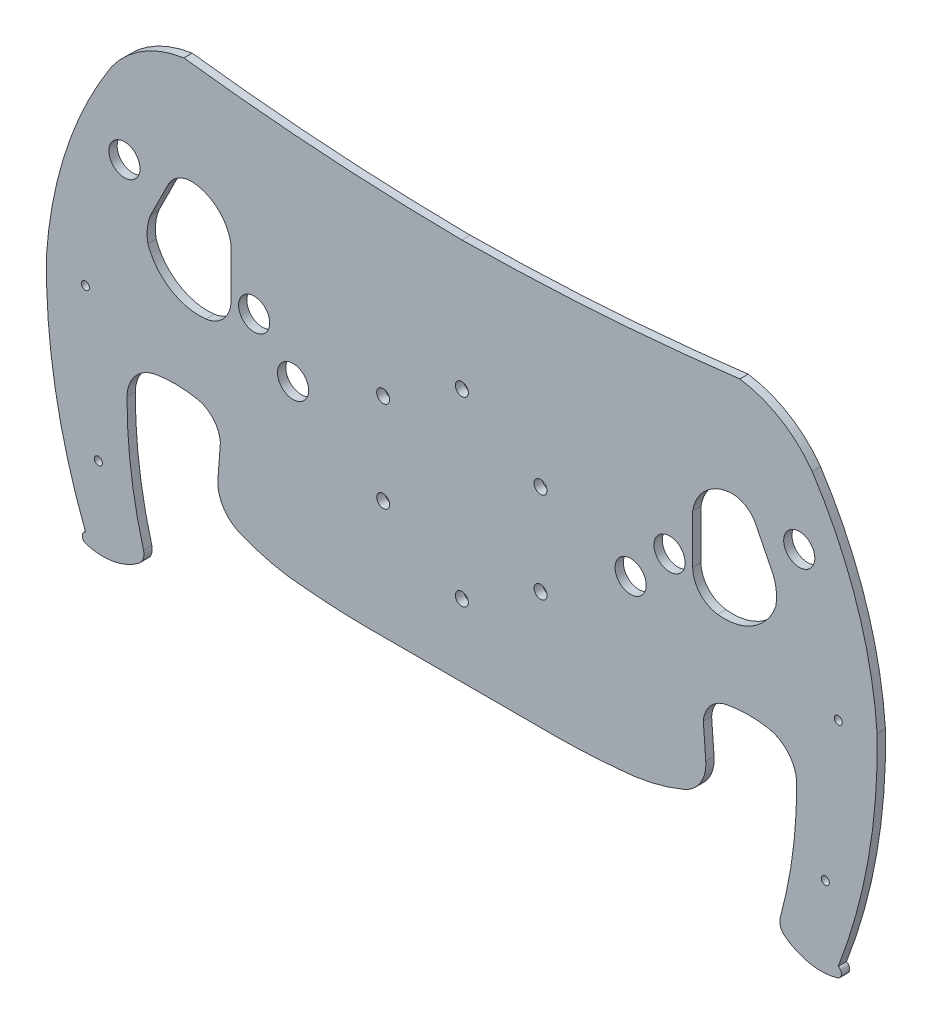
from build123d import *

# Parameters (mm, degrees)
SKETCH2_R           = 1.55
SKETCH2_R_2         = 6
SKETCH2_R_3         = 2.5
BOSS_EXTRUDE1_DEPTH = 3.2


with BuildPart() as part:
    # Sketch2 → Boss-Extrude1 (new body)
    with BuildSketch(Plane.XY):
        with BuildLine():
            Line((-37.606688888, -62.799107474), (37.606688888, -62.799107474))
            ThreePointArc((37.606688888, -62.799107474), (48.801571995, -62.445486831), (59.972328875, -61.630228563))
            ThreePointArc((59.972328875, -61.630228563), (73.015089975, -59.821162533), (85.558909279, -55.816298707))
            ThreePointArc((85.558909279, -55.816298707), (91.976349194, -50.332295109), (93.972328875, -42.130228563))
            Line((93.972328875, -42.130228563), (93.027953895, -29.351478281))
            ThreePointArc((93.027953895, -29.351478281), (95.742249073, -22.868177437), (101.827930469, -19.351777277))
            ThreePointArc((101.827930469, -19.351777277), (109.903770401, -18.491114916), (118, -19.132205072))
            ThreePointArc((118, -19.132205072), (125.861366739, -23.634125523), (129, -32.132205072))
            ThreePointArc((129, -32.132205072), (127.471762842, -56.297585918), (122.65808311, -80.027938374))
            ThreePointArc((122.65808311, -80.027938374), (122.741653332, -82.9548656), (124.449843954, -85.333094304))
            ThreePointArc((124.449843954, -85.333094304), (134.106812923, -89.628818458), (144.665008336, -89.144251365))
            ThreePointArc((144.665008336, -89.144251365), (146.218821849, -87.253980838), (145, -85.132205072))
            ThreePointArc((145, -85.132205072), (156.646327108, -43.296671083), (159.999998592, 0))
            ThreePointArc((159.999998592, 0), (152.263680347, 39.087893918), (134.999998592, 75))
            ThreePointArc((134.999998592, 75), (122.785714167, 86.318698338), (107.103701402, 91.920140268))
            ThreePointArc((107.103701402, 91.920140268), (53.654087158, 86.806881933), (0, 84.746395368))
            ThreePointArc((0, 84.746395368), (-53.654087158, 86.806881933), (-107.103701402, 91.920140268))
            ThreePointArc((-107.103701402, 91.920140268), (-122.785714167, 86.318698338), (-134.999998592, 75))
            ThreePointArc((-134.999998592, 75), (-152.263680347, 39.087893918), (-159.999998592, 0))
            ThreePointArc((-159.999998592, 0), (-156.646327108, -43.296671083), (-145, -85.132205072))
            ThreePointArc((-145, -85.132205072), (-146.218821849, -87.253980838), (-144.665008336, -89.144251365))
            ThreePointArc((-144.665008336, -89.144251365), (-134.106812923, -89.628818458), (-124.449843954, -85.333094304))
            ThreePointArc((-124.449843954, -85.333094304), (-122.741653332, -82.9548656), (-122.65808311, -80.027938374))
            ThreePointArc((-122.65808311, -80.027938374), (-127.471762842, -56.297585918), (-129, -32.132205072))
            ThreePointArc((-129, -32.132205072), (-125.861366739, -23.634125523), (-118, -19.132205072))
            ThreePointArc((-118, -19.132205072), (-109.903770401, -18.491114916), (-101.827930469, -19.351777277))
            ThreePointArc((-101.827930469, -19.351777277), (-95.742249073, -22.868177437), (-93.027953895, -29.351478281))
            Line((-93.027953895, -29.351478281), (-93.972328875, -42.130228563))
            ThreePointArc((-93.972328875, -42.130228563), (-91.976349194, -50.332295109), (-85.558909279, -55.816298707))
            ThreePointArc((-85.558909279, -55.816298707), (-73.015089975, -59.821162533), (-59.972328875, -61.630228563))
            ThreePointArc((-59.972328875, -61.630228563), (-48.801571995, -62.445486831), (-37.606688888, -62.799107474))
        make_face()
        with Locations((145.027741118, -2.999996549)):
            Circle(SKETCH2_R, mode=Mode.SUBTRACT)
        with Locations((80.027671125, 20)):
            Circle(SKETCH2_R_2, mode=Mode.SUBTRACT)
        with Locations((140.027625835, -59.000005176)):
            Circle(SKETCH2_R, mode=Mode.SUBTRACT)
        with Locations((129.987526969, 46.510623474)):
            Circle(SKETCH2_R_2, mode=Mode.SUBTRACT)
        with Locations((65.027671125, 5)):
            Circle(SKETCH2_R_2, mode=Mode.SUBTRACT)
        with Locations((0, 35)):
            Circle(SKETCH2_R_3, mode=Mode.SUBTRACT)
        with Locations((30.310889132, 17.5)):
            Circle(SKETCH2_R_3, mode=Mode.SUBTRACT)
        with Locations((30.310889132, -17.5)):
            Circle(SKETCH2_R_3, mode=Mode.SUBTRACT)
        with Locations((0, -35)):
            Circle(SKETCH2_R_3, mode=Mode.SUBTRACT)
        with Locations((-30.310889132, -17.5)):
            Circle(SKETCH2_R_3, mode=Mode.SUBTRACT)
        with Locations((-30.310889132, 17.5)):
            Circle(SKETCH2_R_3, mode=Mode.SUBTRACT)
        with Locations((-65.027671125, 5)):
            Circle(SKETCH2_R_2, mode=Mode.SUBTRACT)
        with Locations((-129.987526969, 46.510623474)):
            Circle(SKETCH2_R_2, mode=Mode.SUBTRACT)
        with Locations((-140.027625835, -59.000005176)):
            Circle(SKETCH2_R, mode=Mode.SUBTRACT)
        with Locations((-80.027671125, 20)):
            Circle(SKETCH2_R_2, mode=Mode.SUBTRACT)
        with Locations((-145.027741118, -2.999996549)):
            Circle(SKETCH2_R, mode=Mode.SUBTRACT)
        with BuildLine():
            Line((88.932649847, 20), (88.932649847, 38.765088603))
            ThreePointArc((88.932649847, 38.765088603), (93.755318616, 47.8620051), (103.122117375, 52.136944261))
            ThreePointArc((103.122117375, 52.136944261), (109.007507929, 50.935597689), (113.169909334, 46.604839083))
            Line((113.169909334, 46.604839083), (119.972328875, 33))
            ThreePointArc((119.972328875, 33), (121.177690194, 28.070536132), (120.972328875, 23))
            ThreePointArc((120.972328875, 23), (112.239255936, 12.094273751), (98.596517329, 9.081449277))
            ThreePointArc((98.596517329, 9.081449277), (91.695615864, 12.709508168), (88.932649847, 20))
        make_face(mode=Mode.SUBTRACT)
        with BuildLine():
            Line((-113.169909334, 46.604839083), (-119.972328875, 33))
            ThreePointArc((-119.972328875, 33), (-121.177690194, 28.070536132), (-120.972328875, 23))
            ThreePointArc((-120.972328875, 23), (-112.239255936, 12.094273751), (-98.596517329, 9.081449277))
            ThreePointArc((-98.596517329, 9.081449277), (-91.695615864, 12.709508168), (-88.932649847, 20))
            Line((-88.932649847, 20), (-88.932649847, 38.765088603))
            ThreePointArc((-88.932649847, 38.765088603), (-93.755318616, 47.8620051), (-103.122117375, 52.136944261))
            ThreePointArc((-103.122117375, 52.136944261), (-109.007507929, 50.935597689), (-113.169909334, 46.604839083))
        make_face(mode=Mode.SUBTRACT)
    extrude(amount=BOSS_EXTRUDE1_DEPTH)


solid = part.part
